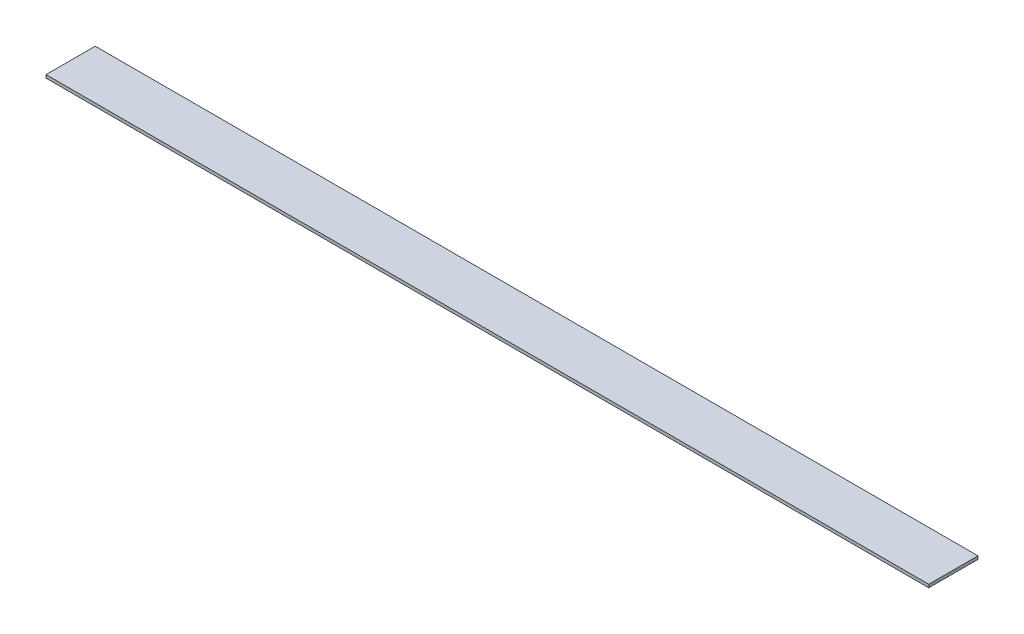
from build123d import *

# Parameters (mm, degrees)
SKETCH1_W           = 910.88
SKETCH1_H           = 50.8
BOSS_EXTRUDE1_DEPTH = 3.175


with BuildPart() as part:
    # Sketch1 → Boss-Extrude1 (new body)
    with BuildSketch(Plane(origin=(0, 0, 0), x_dir=(1, 0, 0), z_dir=(0, 1, 0))):
        with Locations((455.44, 25.4)):
            Rectangle(SKETCH1_W, SKETCH1_H)
    extrude(amount=BOSS_EXTRUDE1_DEPTH)


solid = part.part
